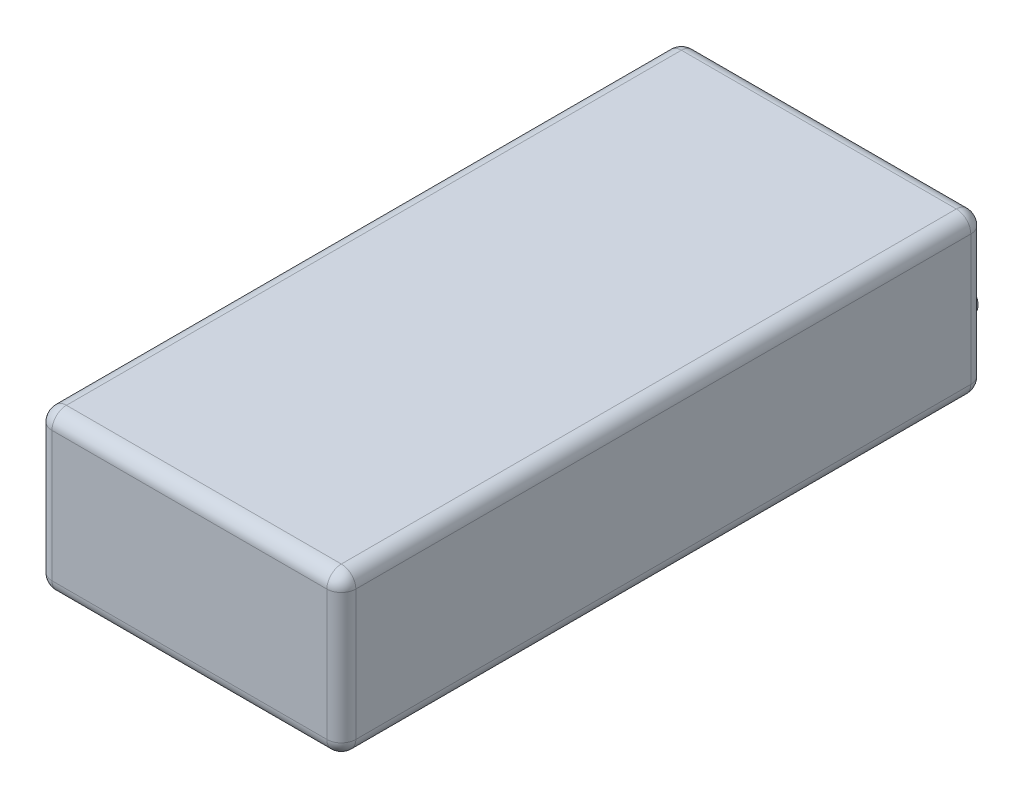
from build123d import *

# Parameters (mm, degrees)
EXTRUDE_370_DEPTH      = 11
EXTRUDE_370_DEPTH_BACK = 11
SKETCH_1_W             = 42
SKETCH_1_H             = 89
SKETCH_2_W             = 7
SKETCH_2_H             = 5
EXTRUDE_597_DEPTH      = 2
SKETCH_3_R             = 2
EXTRUDE_827_DEPTH      = 5
SKETCH_4_R             = 2.5
CUT_EXTRUDE_1027_DEPTH = 10
FILLET_1_R             = 2


with BuildPart() as part:
    # Эскиз1 → Extrude 370 (new, two sides: drawn at the far end of the back side and taken through both)
    with BuildSketch(Plane(origin=(0, 0, 0), x_dir=(1, 0, 0), z_dir=(0, 1, 0)).offset(-EXTRUDE_370_DEPTH_BACK)):
        Rectangle(SKETCH_1_W, SKETCH_1_H)
    extrude(amount=EXTRUDE_370_DEPTH + EXTRUDE_370_DEPTH_BACK)

    # Эскиз2 → Extrude 597 (add)
    with BuildSketch(Plane(origin=(0, 0, -44.5), x_dir=(-1, 0, 0), z_dir=(0, 0, -1))):
        with Locations((9, 1)):
            Rectangle(SKETCH_2_W, SKETCH_2_H)
    extrude(amount=EXTRUDE_597_DEPTH)

    # Эскиз3 → Extrude 827 (add)
    with BuildSketch(Plane(origin=(0, 0, -44.5), x_dir=(-1, 0, 0), z_dir=(0, 0, -1))):
        with Locations((-13, -6)):
            Circle(SKETCH_3_R)
    extrude(amount=EXTRUDE_827_DEPTH)

    # Эскиз4 → Cut-Extrude 1027 (cut)
    with BuildSketch(Plane.XZ.offset(11)):
        with Locations((-12, 25.5)):
            Circle(SKETCH_4_R)
        with Locations((12, 25.5)):
            Circle(SKETCH_4_R)
        with Locations((12, -14.5)):
            Circle(SKETCH_4_R)
        with Locations((-12, -14.5)):
            Circle(SKETCH_4_R)
    extrude(amount=-CUT_EXTRUDE_1027_DEPTH, mode=Mode.SUBTRACT)

    # Скругление1
    fillet_1_edges = [part.edges().sort_by_distance(p)[0] for p in [
        (0, -11, -44.5),
        (-21, -11, 0),
        (-21, 0, -44.5),
        (21, -11, 0),
        (21, 0, -44.5),
        (0, -11, 44.5),
        (-21, 0, 44.5),
        (21, 0, 44.5),
        (0, 11, 44.5),
        (-21, 11, 0),
        (0, 11, -44.5),
        (21, 11, 0),
    ]]
    fillet(fillet_1_edges, radius=FILLET_1_R)


solid = part.part
